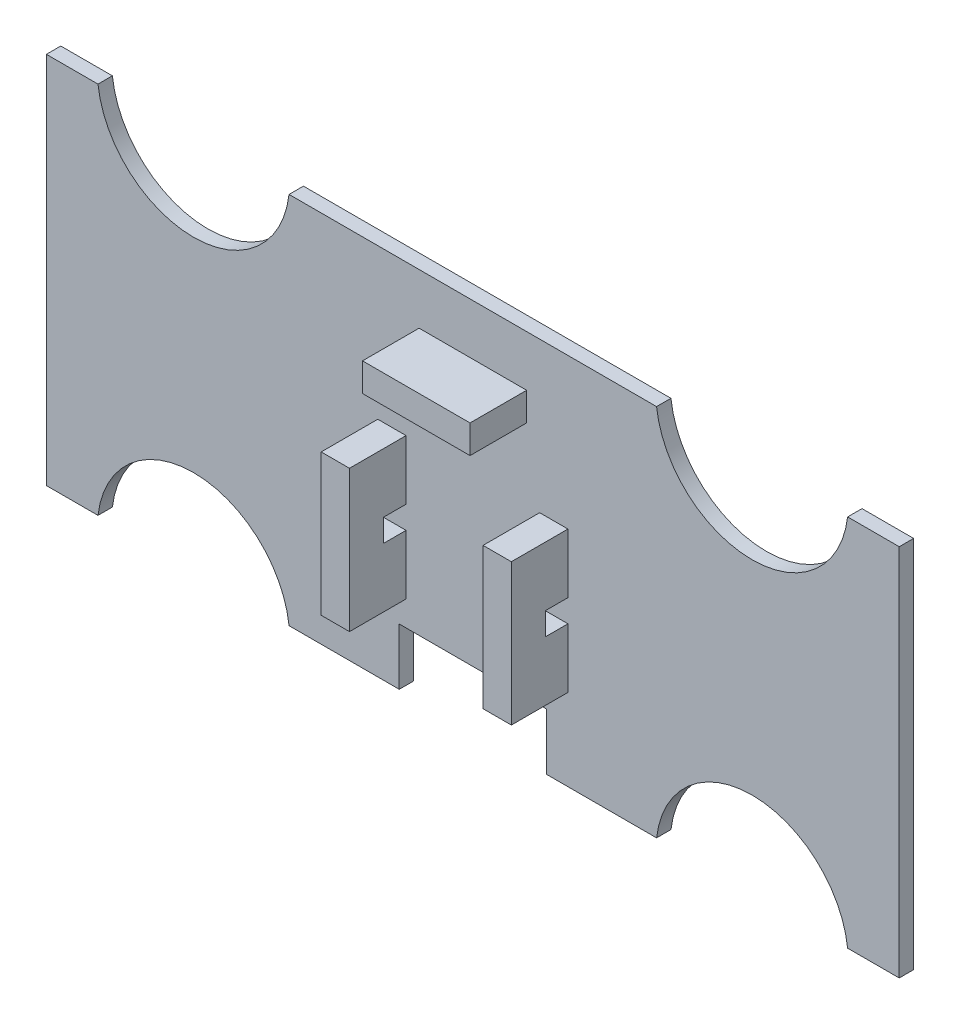
from build123d import *

# Parameters (mm, degrees)
BOSS_EXTRUDE1_DEPTH = 2.54
SKETCH2_W           = 26.0160991
SKETCH2_H           = 10
CUT_EXTRUDE1_DEPTH  = 2.54
SKETCH6_W           = 5
SKETCH6_H           = 25
BOSS_EXTRUDE2_DEPTH = 10
SKETCH6_3_W         = 19
SKETCH6_3_H         = 5
BOSS_EXTRUDE3_DEPTH = 10
SKETCH6_4_W         = 5
SKETCH6_4_H         = 25
BOSS_EXTRUDE4_DEPTH = 10
SKETCH9_W           = 4
SKETCH9_H           = 4
CUT_EXTRUDE3_DEPTH  = 99.671329208


with BuildPart() as part:
    # Sketch1 → Boss-Extrude1 (new body)
    with BuildSketch(Plane.XY):
        with BuildLine():
            Line((-32.468057, 32.999999883), (-13, 32.999999883))
            Line((-13, 32.999999883), (13, 32.999999883))
            Line((13, 32.999999883), (32.468057241, 32.999999883))
            ThreePointArc((32.468057241, 32.999999883), (49.350000777, 18.000000029), (66.231944118, 33.000000103))
            Line((66.231944118, 33.000000103), (75.350000118, 33.000000103))
            Line((75.350000118, 33.000000103), (75.350000118, -32.999998949))
            Line((75.350000118, -32.999998949), (66.231943, -32.999998949))
            ThreePointArc((66.231943, -32.999998949), (49.349999056, -17.999999409), (32.468056, -32.999999949))
            Line((32.468056, -32.999999949), (13, -32.999999949))
            Line((13, -32.999999949), (-12.999999882, -32.999999949))
            Line((-12.999999882, -32.999999949), (-32.468057, -32.999999117))
            ThreePointArc((-32.468057, -32.999999117), (-49.350000944, -17.999999578), (-66.231944, -33.000000117))
            Line((-66.231944, -33.000000117), (-75.35, -33.000000117))
            Line((-75.35, -33.000000117), (-75.35, 32.999999883))
            Line((-75.35, 32.999999883), (-66.231944, 32.999999883))
            ThreePointArc((-66.231944, 32.999999883), (-49.3500005, 17.999999403), (-32.468057, 32.999999883))
        make_face()
    extrude(amount=BOSS_EXTRUDE1_DEPTH)

    # Sketch2 → Cut-Extrude1 (cut)
    with BuildSketch(Plane.XY.offset(2.54)):
        with Locations((0.008049668, -27.999999949)):
            Rectangle(SKETCH2_W, SKETCH2_H)
    extrude(amount=-CUT_EXTRUDE1_DEPTH, mode=Mode.SUBTRACT)

    # Sketch6 → Boss-Extrude2 (add)
    with BuildSketch(Plane.XY.offset(2.54)):
        with Locations((-14.289999882, -6.066775281)):
            Rectangle(SKETCH6_W, SKETCH6_H)
    extrude(amount=BOSS_EXTRUDE2_DEPTH)

    # Sketch6<3> → Boss-Extrude3 (add)
    with BuildSketch(Plane.XY.offset(2.54)):
        with Locations((0.010000118, 21.520000051)):
            Rectangle(SKETCH6_3_W, SKETCH6_3_H)
    extrude(amount=BOSS_EXTRUDE3_DEPTH)

    # Sketch6<4> → Boss-Extrude4 (add)
    with BuildSketch(Plane.XY.offset(2.54)):
        with Locations((14.310000118, -6.066775281)):
            Rectangle(SKETCH6_4_W, SKETCH6_4_H)
    extrude(amount=BOSS_EXTRUDE4_DEPTH)

    # Sketch9 → Cut-Extrude3 (cut, through all)
    with BuildSketch(Plane.ZY.offset(16.789999882)):
        with Locations((4.54, -6.066775281)):
            Rectangle(SKETCH9_W, SKETCH9_H)
    extrude(amount=-CUT_EXTRUDE3_DEPTH, mode=Mode.SUBTRACT)


solid = part.part
